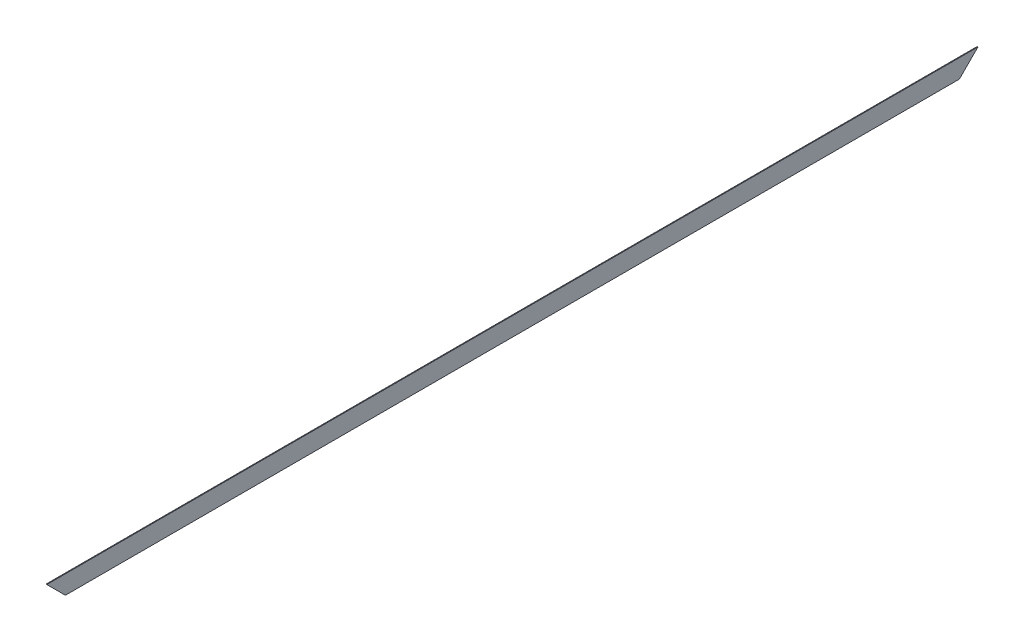
from build123d import *

# Parameters (mm, degrees)
SALIENTE_EXTRUIR1_DEPTH    = 1500
CORTAR_EXTRUIR1_DEPTH      = 10
CORTAR_EXTRUIR1_DEPTH_BACK = 40


with BuildPart() as part:
    # Croquis3 → Saliente-Extruir1 (new body)
    with BuildSketch(Plane(origin=(0, 0, 0), x_dir=(-1, 0, 0), z_dir=(0, 0, -1))):
        with BuildLine():
            Line((-4.77501925, 0), (-4.77501925, 30))
            ThreePointArc((-4.77501925, 30), (-2.653698906, 29.121320344), (-1.77501925, 27))
            Line((-1.77501925, 27), (-1.77501925, 8))
            ThreePointArc((-1.77501925, 8), (-0.310553156, 4.464466094), (3.22498075, 3))
            Line((3.22498075, 3), (22.22498075, 3))
            ThreePointArc((22.22498075, 3), (24.346301094, 2.121320344), (25.22498075, 0))
            Line((25.22498075, 0), (-4.77501925, 0))
        make_face()
    extrude(amount=-SALIENTE_EXTRUIR1_DEPTH)

    # Croquis4 → Cortar-Extruir1 (cut, two sides: drawn at the far end of the back side and taken through both)
    with BuildSketch(Plane(origin=(0, 0, 0), x_dir=(0, 0, -1), z_dir=(1, 0, 0)).offset(-CORTAR_EXTRUIR1_DEPTH_BACK)):
        Polygon((-1500, 0), (-1470, 0), (-1500, 30), align=None)
        Polygon((0, 0), (-30, 0), (0, 30), align=None)
    extrude(amount=CORTAR_EXTRUIR1_DEPTH + CORTAR_EXTRUIR1_DEPTH_BACK, mode=Mode.SUBTRACT)


solid = part.part
